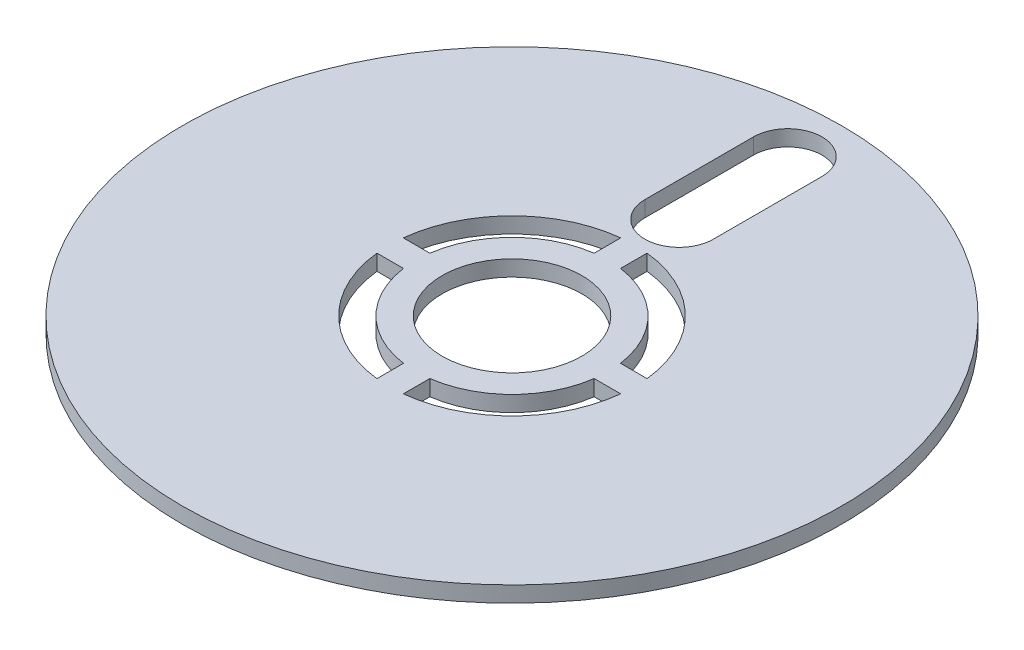
from build123d import *

# Parameters (mm, degrees)
SKETCH1_R           = 62.5
SKETCH1_R_2         = 13.25
BOSS_EXTRUDE1_DEPTH = 3
CUT_EXTRUDE1_DEPTH  = 89.439244682


with BuildPart() as part:
    # Sketch1 → Boss-Extrude1 (new body)
    with BuildSketch(Plane(origin=(0, 0, 0), x_dir=(1, 0, 0), z_dir=(0, 1, 0))):
        with Locations(Location((0, 0, 0), (0, 0, 270))):
            Circle(SKETCH1_R)
        with Locations(Location((0, 0, 0), (0, 0, 270))):
            Circle(SKETCH1_R_2, mode=Mode.SUBTRACT)
        with BuildLine():
            Line((-2.5, 18.07795619), (-2.5, 23.115200626))
            ThreePointArc((-2.5, 23.115200626), (-16.440232663, 16.440232663), (-23.115200626, 2.5))
            Line((-23.115200626, 2.5), (-18.07795619, 2.5))
            ThreePointArc((-18.07795619, 2.5), (-12.904698757, 12.904698757), (-2.5, 18.07795619))
        make_face(mode=Mode.SUBTRACT)
        with BuildLine():
            Line((2.5, 18.07795619), (2.5, 23.115200626))
            ThreePointArc((2.5, 23.115200626), (16.440232663, 16.440232663), (23.115200626, 2.5))
            Line((23.115200626, 2.5), (18.07795619, 2.5))
            ThreePointArc((18.07795619, 2.5), (12.904698757, 12.904698757), (2.5, 18.07795619))
        make_face(mode=Mode.SUBTRACT)
        with BuildLine():
            Line((18.07795619, -2.5), (23.115200626, -2.5))
            ThreePointArc((23.115200626, -2.5), (16.440232663, -16.440232663), (2.5, -23.115200626))
            Line((2.5, -23.115200626), (2.5, -18.07795619))
            ThreePointArc((2.5, -18.07795619), (12.904698757, -12.904698757), (18.07795619, -2.5))
        make_face(mode=Mode.SUBTRACT)
        with BuildLine():
            Line((-2.5, -18.07795619), (-2.5, -23.115200626))
            ThreePointArc((-2.5, -23.115200626), (-16.440232663, -16.440232663), (-23.115200626, -2.5))
            Line((-23.115200626, -2.5), (-18.07795619, -2.5))
            ThreePointArc((-18.07795619, -2.5), (-12.904698757, -12.904698757), (-2.5, -18.07795619))
        make_face(mode=Mode.SUBTRACT)
    extrude(amount=BOSS_EXTRUDE1_DEPTH)

    # Sketch4 → Cut-Extrude1 (cut, through all)
    with BuildSketch(Plane(origin=(0, 3, 0), x_dir=(1, 0, 0), z_dir=(0, 1, 0))):
        with BuildLine():
            Line((-6.5, 31.7), (-6.5, 52.3))
            ThreePointArc((-6.5, 52.3), (0, 58.8), (6.5, 52.3))
            Line((6.5, 52.3), (6.5, 31.7))
            ThreePointArc((6.5, 31.7), (0, 25.2), (-6.5, 31.7))
        make_face()
    extrude(amount=-CUT_EXTRUDE1_DEPTH, mode=Mode.SUBTRACT)


solid = part.part
